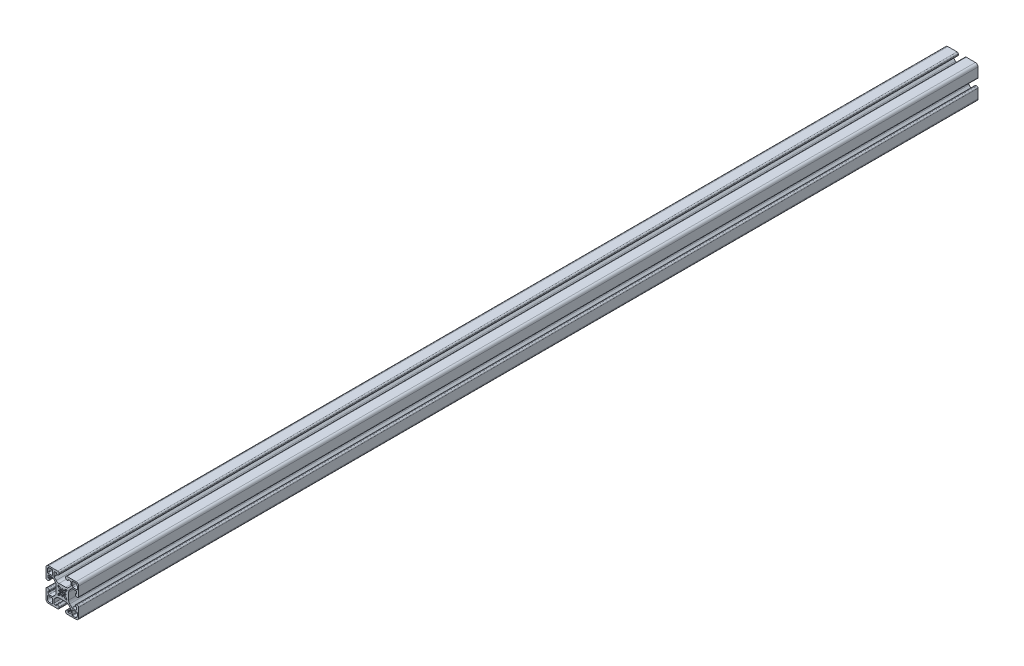
from build123d import *

# Parameters (mm, degrees)
EXTRUDE1_DEPTH = 550


with BuildPart() as part:
    # Sketch1 → Extrude1 (new, symmetric)
    with BuildSketch(Plane.XY):
        with BuildLine():
            Line((-5.63, 20), (-16.83, 20))
            ThreePointArc((-16.83, 20), (-19.071528496, 19.071528497), (-20, 16.83))
            Line((-20, 16.83), (-20, 5.63))
            ThreePointArc((-20, 5.63), (-19.540157646, 4.519842354), (-18.43, 4.06))
            Line((-18.43, 4.06), (-17.57, 4.06))
            ThreePointArc((-17.57, 4.06), (-16.459842353, 4.519842354), (-16, 5.63))
            Line((-16, 5.63), (-16, 6.605))
            ThreePointArc((-16, 6.605), (-16.073223305, 6.781776695), (-16.25, 6.855))
            Line((-16.25, 6.855), (-17.25, 6.855))
            ThreePointArc((-17.25, 6.855), (-17.426776695, 6.928223305), (-17.5, 7.105))
            Line((-17.5, 7.105), (-17.5, 9.015))
            ThreePointArc((-17.5, 9.015), (-17.128025612, 9.913025612), (-16.23, 10.285))
            Line((-16.23, 10.285), (-12.216214635, 10.285))
            ThreePointArc((-12.216214635, 10.285), (-11.875626381, 10.217252784), (-11.5868896, 10.024325035))
            Line((-11.5868896, 10.024325035), (-9.076242789, 7.513678225))
            ThreePointArc((-9.076242789, 7.513678225), (-8.04657222, 5.972667318), (-7.685, 4.154921014))
            Line((-7.685, 4.154921014), (-7.685, -4.154921014))
            ThreePointArc((-7.685, -4.154921014), (-8.04657222, -5.972667317), (-9.076242789, -7.513678224))
            Line((-9.076242789, -7.513678224), (-11.5868896, -10.024325035))
            ThreePointArc((-11.5868896, -10.024325035), (-11.875626381, -10.217252784), (-12.216214635, -10.285))
            Line((-12.216214635, -10.285), (-16.23, -10.285))
            ThreePointArc((-16.23, -10.285), (-17.128025612, -9.913025612), (-17.5, -9.015))
            Line((-17.5, -9.015), (-17.5, -7.105))
            ThreePointArc((-17.5, -7.105), (-17.426776695, -6.928223305), (-17.25, -6.855))
            Line((-17.25, -6.855), (-16.25, -6.855))
            ThreePointArc((-16.25, -6.855), (-16.073223305, -6.781776695), (-16, -6.605))
            Line((-16, -6.605), (-16, -5.63))
            ThreePointArc((-16, -5.63), (-16.459842353, -4.519842353), (-17.57, -4.06))
            Line((-17.57, -4.06), (-18.43, -4.06))
            ThreePointArc((-18.43, -4.06), (-19.540157646, -4.519842353), (-20, -5.63))
            Line((-20, -5.63), (-20, -16.83))
            ThreePointArc((-20, -16.83), (-19.071528496, -19.071528496), (-16.83, -20))
            Line((-16.83, -20), (-5.63, -20))
            ThreePointArc((-5.63, -20), (-4.519842353, -19.540157646), (-4.06, -18.43))
            Line((-4.06, -18.43), (-4.06, -17.57))
            ThreePointArc((-4.06, -17.57), (-4.519842353, -16.459842353), (-5.63, -16))
            Line((-5.63, -16), (-6.605, -16))
            ThreePointArc((-6.605, -16), (-6.781776695, -16.073223305), (-6.855, -16.25))
            Line((-6.855, -16.25), (-6.855, -17.25))
            ThreePointArc((-6.855, -17.25), (-6.928223305, -17.426776695), (-7.105, -17.5))
            Line((-7.105, -17.5), (-9.015, -17.5))
            ThreePointArc((-9.015, -17.5), (-9.913025612, -17.128025612), (-10.285, -16.23))
            Line((-10.285, -16.23), (-10.285, -12.216214636))
            ThreePointArc((-10.285, -12.216214636), (-10.217252784, -11.875626381), (-10.024325035, -11.5868896))
            Line((-10.024325035, -11.5868896), (-7.513678224, -9.076242789))
            ThreePointArc((-7.513678224, -9.076242789), (-5.972667317, -8.046572221), (-4.154921014, -7.685))
            Line((-4.154921014, -7.685), (4.154921014, -7.685))
            ThreePointArc((4.154921014, -7.685), (5.972667318, -8.046572221), (7.513678225, -9.076242789))
            Line((7.513678225, -9.076242789), (10.024325035, -11.5868896))
            ThreePointArc((10.024325035, -11.5868896), (10.217252784, -11.87562638), (10.285, -12.216214635))
            Line((10.285, -12.216214635), (10.285, -16.23))
            ThreePointArc((10.285, -16.23), (9.913025612, -17.128025612), (9.015, -17.5))
            Line((9.015, -17.5), (7.105, -17.5))
            ThreePointArc((7.105, -17.5), (6.928223305, -17.426776695), (6.855, -17.25))
            Line((6.855, -17.25), (6.855, -16.25))
            ThreePointArc((6.855, -16.25), (6.781776695, -16.073223305), (6.605, -16))
            Line((6.605, -16), (5.63, -16))
            ThreePointArc((5.63, -16), (4.519842354, -16.459842353), (4.06, -17.57))
            Line((4.06, -17.57), (4.06, -18.43))
            ThreePointArc((4.06, -18.43), (4.519842354, -19.540157646), (5.63, -20))
            Line((5.63, -20), (16.83, -20))
            ThreePointArc((16.83, -20), (19.071528496, -19.071528496), (20, -16.83))
            Line((20, -16.83), (20, -5.63))
            ThreePointArc((20, -5.63), (19.540157647, -4.519842353), (18.43, -4.06))
            Line((18.43, -4.06), (17.57, -4.06))
            ThreePointArc((17.57, -4.06), (16.459842354, -4.519842353), (16, -5.63))
            Line((16, -5.63), (16, -6.605))
            ThreePointArc((16, -6.605), (16.073223305, -6.781776695), (16.25, -6.855))
            Line((16.25, -6.855), (17.25, -6.855))
            ThreePointArc((17.25, -6.855), (17.426776695, -6.928223305), (17.5, -7.105))
            Line((17.5, -7.105), (17.5, -9.015))
            ThreePointArc((17.5, -9.015), (17.128025612, -9.913025612), (16.23, -10.285))
            Line((16.23, -10.285), (12.216214636, -10.285))
            ThreePointArc((12.216214636, -10.285), (11.875626381, -10.217252784), (11.5868896, -10.024325035))
            Line((11.5868896, -10.024325035), (9.076242789, -7.513678224))
            ThreePointArc((9.076242789, -7.513678224), (8.046572221, -5.972667317), (7.685, -4.154921014))
            Line((7.685, -4.154921014), (7.685, 4.154921014))
            ThreePointArc((7.685, 4.154921014), (8.046572221, 5.972667318), (9.076242789, 7.513678224))
            Line((9.076242789, 7.513678224), (11.5868896, 10.024325035))
            ThreePointArc((11.5868896, 10.024325035), (11.875626381, 10.217252784), (12.216214636, 10.285))
            Line((12.216214636, 10.285), (16.23, 10.285))
            ThreePointArc((16.23, 10.285), (17.128025612, 9.913025612), (17.5, 9.015))
            Line((17.5, 9.015), (17.5, 7.105))
            ThreePointArc((17.5, 7.105), (17.426776695, 6.928223305), (17.25, 6.855))
            Line((17.25, 6.855), (16.25, 6.855))
            ThreePointArc((16.25, 6.855), (16.073223305, 6.781776695), (16, 6.605))
            Line((16, 6.605), (16, 5.63))
            ThreePointArc((16, 5.63), (16.459842354, 4.519842354), (17.57, 4.06))
            Line((17.57, 4.06), (18.43, 4.06))
            ThreePointArc((18.43, 4.06), (19.540157647, 4.519842354), (20, 5.63))
            Line((20, 5.63), (20, 16.83))
            ThreePointArc((20, 16.83), (19.071528496, 19.071528497), (16.83, 20))
            Line((16.83, 20), (5.63, 20))
            ThreePointArc((5.63, 20), (4.519842354, 19.540157647), (4.06, 18.43))
            Line((4.06, 18.43), (4.06, 17.57))
            ThreePointArc((4.06, 17.57), (4.519842354, 16.459842354), (5.63, 16))
            Line((5.63, 16), (6.605, 16))
            ThreePointArc((6.605, 16), (6.781776695, 16.073223305), (6.855, 16.25))
            Line((6.855, 16.25), (6.855, 17.25))
            ThreePointArc((6.855, 17.25), (6.928223305, 17.426776695), (7.105, 17.5))
            Line((7.105, 17.5), (9.015, 17.5))
            ThreePointArc((9.015, 17.5), (9.913025612, 17.128025612), (10.285, 16.23))
            Line((10.285, 16.23), (10.285, 12.216214636))
            ThreePointArc((10.285, 12.216214636), (10.217252784, 11.875626381), (10.024325035, 11.5868896))
            Line((10.024325035, 11.5868896), (7.513678224, 9.07624279))
            ThreePointArc((7.513678224, 9.07624279), (5.972667318, 8.046572221), (4.154921014, 7.685))
            Line((4.154921014, 7.685), (-4.154921014, 7.685))
            ThreePointArc((-4.154921014, 7.685), (-5.972667317, 8.046572221), (-7.513678224, 9.07624279))
            Line((-7.513678224, 9.07624279), (-10.024325035, 11.5868896))
            ThreePointArc((-10.024325035, 11.5868896), (-10.217252784, 11.875626381), (-10.285, 12.216214636))
            Line((-10.285, 12.216214636), (-10.285, 16.23))
            ThreePointArc((-10.285, 16.23), (-9.913025612, 17.128025612), (-9.015, 17.5))
            Line((-9.015, 17.5), (-7.105, 17.5))
            ThreePointArc((-7.105, 17.5), (-6.928223305, 17.426776695), (-6.855, 17.25))
            Line((-6.855, 17.25), (-6.855, 16.25))
            ThreePointArc((-6.855, 16.25), (-6.781776695, 16.073223305), (-6.605, 16))
            Line((-6.605, 16), (-5.63, 16))
            ThreePointArc((-5.63, 16), (-4.519842353, 16.459842354), (-4.06, 17.57))
            Line((-4.06, 17.57), (-4.06, 18.43))
            ThreePointArc((-4.06, 18.43), (-4.519842353, 19.540157647), (-5.63, 20))
        make_face()
        with BuildLine():
            Line((-5.126252184, -3.712038621), (-5.43930974, -4.848116849))
            ThreePointArc((-5.43930974, -4.848116849), (-5.303300859, -5.303300859), (-4.84811685, -5.43930974))
            Line((-4.84811685, -5.43930974), (-3.712038621, -5.126252183))
            Line((-3.712038621, -5.126252183), (-1.590718277, -3.00493184))
            ThreePointArc((-1.590718277, -3.00493184), (-1.120609643, -3.210020877), (-0.625, -3.342061489))
            Line((-0.625, -3.342061489), (-0.492259234, -4.087640441))
            ThreePointArc((-0.492259234, -4.087640441), (0, -4.5), (0.492259234, -4.087640441))
            Line((0.492259234, -4.087640441), (0.625, -3.342061489))
            ThreePointArc((0.625, -3.342061489), (1.120609643, -3.210020877), (1.590718277, -3.00493184))
            Line((1.590718277, -3.00493184), (3.712038621, -5.126252184))
            Line((3.712038621, -5.126252184), (4.84811685, -5.43930974))
            ThreePointArc((4.84811685, -5.43930974), (5.303300859, -5.303300859), (5.43930974, -4.848116849))
            Line((5.43930974, -4.848116849), (5.126252184, -3.712038621))
            Line((5.126252184, -3.712038621), (3.00493184, -1.590718277))
            ThreePointArc((3.00493184, -1.590718277), (3.210020877, -1.120609643), (3.342061489, -0.625))
            Line((3.342061489, -0.625), (4.087640441, -0.492259234))
            ThreePointArc((4.087640441, -0.492259234), (4.5, 0), (4.087640441, 0.492259234))
            Line((4.087640441, 0.492259234), (3.342061489, 0.625))
            ThreePointArc((3.342061489, 0.625), (3.210020877, 1.120609643), (3.00493184, 1.590718277))
            Line((3.00493184, 1.590718277), (5.126252183, 3.712038621))
            Line((5.126252183, 3.712038621), (5.43930974, 4.84811685))
            ThreePointArc((5.43930974, 4.84811685), (5.303300859, 5.303300859), (4.848116849, 5.43930974))
            Line((4.848116849, 5.43930974), (3.712038621, 5.126252184))
            Line((3.712038621, 5.126252184), (1.590718277, 3.00493184))
            ThreePointArc((1.590718277, 3.00493184), (1.120609643, 3.210020877), (0.625, 3.342061489))
            Line((0.625, 3.342061489), (0.492259234, 4.087640441))
            ThreePointArc((0.492259234, 4.087640441), (0, 4.5), (-0.492259234, 4.087640441))
            Line((-0.492259234, 4.087640441), (-0.625, 3.342061489))
            ThreePointArc((-0.625, 3.342061489), (-1.120609643, 3.210020877), (-1.590718277, 3.00493184))
            Line((-1.590718277, 3.00493184), (-3.712038621, 5.126252183))
            Line((-3.712038621, 5.126252183), (-4.84811685, 5.43930974))
            ThreePointArc((-4.84811685, 5.43930974), (-5.303300859, 5.303300859), (-5.43930974, 4.84811685))
            Line((-5.43930974, 4.84811685), (-5.126252184, 3.712038621))
            Line((-5.126252184, 3.712038621), (-3.00493184, 1.590718277))
            ThreePointArc((-3.00493184, 1.590718277), (-3.210020877, 1.120609643), (-3.342061489, 0.625))
            Line((-3.342061489, 0.625), (-4.087640441, 0.492259234))
            ThreePointArc((-4.087640441, 0.492259234), (-4.5, 0), (-4.087640441, -0.492259234))
            Line((-4.087640441, -0.492259234), (-3.342061489, -0.625))
            ThreePointArc((-3.342061489, -0.625), (-3.210020877, -1.120609643), (-3.00493184, -1.590718277))
            Line((-3.00493184, -1.590718277), (-5.126252184, -3.712038621))
        make_face(mode=Mode.SUBTRACT)
        with BuildLine():
            Line((-12.4898, 18.345), (-15.545, 18.345))
            ThreePointArc((-15.545, 18.345), (-17.524898987, 17.524898987), (-18.345, 15.545))
            Line((-18.345, 15.545), (-18.345, 12.4898))
            ThreePointArc((-18.345, 12.4898), (-18.160477272, 12.044322728), (-17.715, 11.8598))
            Line((-17.715, 11.8598), (-13.1298, 11.8598))
            ThreePointArc((-13.1298, 11.8598), (-12.231774388, 12.231774388), (-11.8598, 13.1298))
            Line((-11.8598, 13.1298), (-11.8598, 17.715))
            ThreePointArc((-11.8598, 17.715), (-12.044322728, 18.160477272), (-12.4898, 18.345))
        make_face(mode=Mode.SUBTRACT)
        with BuildLine():
            Line((18.345, 12.4898), (18.345, 15.545))
            ThreePointArc((18.345, 15.545), (17.524898987, 17.524898987), (15.545, 18.345))
            Line((15.545, 18.345), (12.4898, 18.345))
            ThreePointArc((12.4898, 18.345), (12.044322728, 18.160477272), (11.8598, 17.715))
            Line((11.8598, 17.715), (11.8598, 13.1298))
            ThreePointArc((11.8598, 13.1298), (12.231774388, 12.231774388), (13.1298, 11.8598))
            Line((13.1298, 11.8598), (17.715, 11.8598))
            ThreePointArc((17.715, 11.8598), (18.160477272, 12.044322728), (18.345, 12.4898))
        make_face(mode=Mode.SUBTRACT)
        with BuildLine():
            Line((-18.345, -12.4898), (-18.345, -15.545))
            ThreePointArc((-18.345, -15.545), (-17.524898987, -17.524898987), (-15.545, -18.345))
            Line((-15.545, -18.345), (-12.4898, -18.345))
            ThreePointArc((-12.4898, -18.345), (-12.044322728, -18.160477272), (-11.8598, -17.715))
            Line((-11.8598, -17.715), (-11.8598, -13.1298))
            ThreePointArc((-11.8598, -13.1298), (-12.231774388, -12.231774388), (-13.1298, -11.8598))
            Line((-13.1298, -11.8598), (-17.715, -11.8598))
            ThreePointArc((-17.715, -11.8598), (-18.160477272, -12.044322728), (-18.345, -12.4898))
        make_face(mode=Mode.SUBTRACT)
        with BuildLine():
            Line((12.4898, -18.345), (15.545, -18.345))
            ThreePointArc((15.545, -18.345), (17.524898987, -17.524898987), (18.345, -15.545))
            Line((18.345, -15.545), (18.345, -12.4898))
            ThreePointArc((18.345, -12.4898), (18.160477272, -12.044322728), (17.715, -11.8598))
            Line((17.715, -11.8598), (13.1298, -11.8598))
            ThreePointArc((13.1298, -11.8598), (12.231774388, -12.231774388), (11.8598, -13.1298))
            Line((11.8598, -13.1298), (11.8598, -17.715))
            ThreePointArc((11.8598, -17.715), (12.044322728, -18.160477272), (12.4898, -18.345))
        make_face(mode=Mode.SUBTRACT)
    extrude(amount=EXTRUDE1_DEPTH, both=True)


solid = part.part
